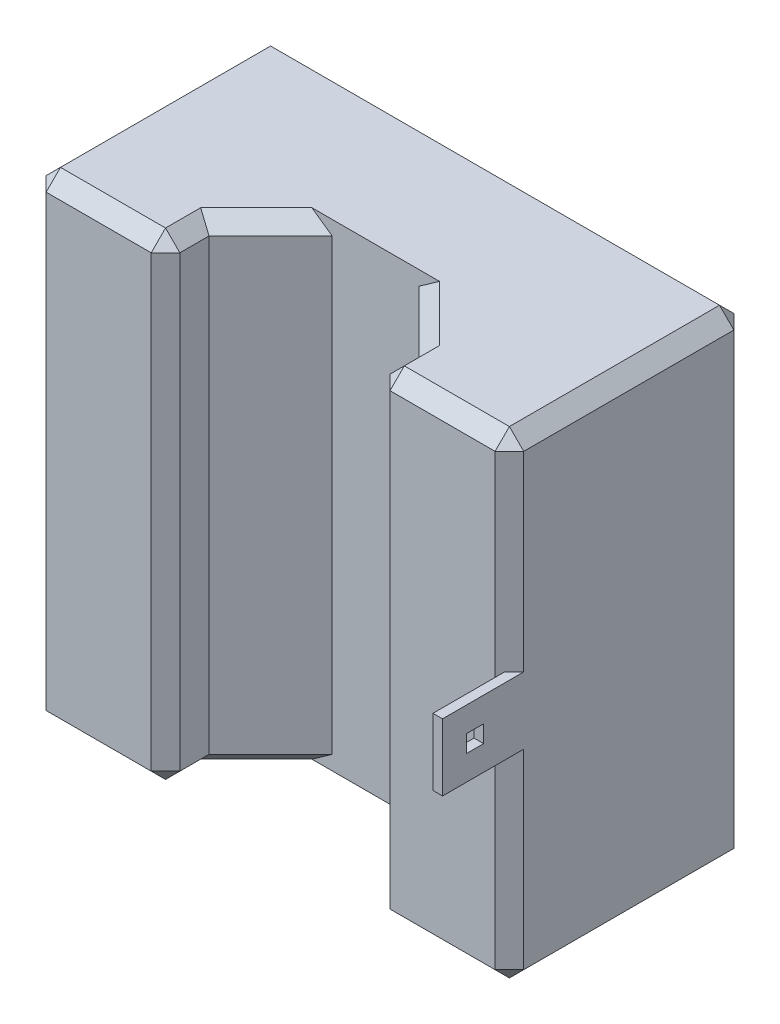
from build123d import *

# Parameters (mm, degrees)
SKETCH1_W                = 50
SKETCH1_H                = 50
BOSS_EXTRUDE1_DEPTH      = 25
CUT_EXTRUDE1_DEPTH       = 76
CHAMFER1_SIZE            = 1.5
BOSS_EXTRUDE2_DEPTH      = 7
BOSS_EXTRUDE2_DEPTH_BACK = 10
SKETCH3_W                = 1
SKETCH3_H                = 7
SKETCH4_W                = 1.8
SKETCH4_H                = 1.8
CUT_EXTRUDE2_DEPTH       = 7


with BuildPart() as part:
    # Sketch1 → Boss-Extrude1 (new body)
    with BuildSketch(Plane.XY):
        with Locations((25, 25)):
            Rectangle(SKETCH1_W, SKETCH1_H)
    extrude(amount=BOSS_EXTRUDE1_DEPTH)

    # Sketch2 → Cut-Extrude1 (cut, through all)
    with BuildSketch(Plane.XZ):
        Polygon((29.556349186, 36), (20.443650814, 36), (14, 29.556349186), (14, 20.443650814), (20.443650814, 14), (29.556349186, 14), (36, 20.443650814), (36, 29.556349186), align=None)
    extrude(amount=-CUT_EXTRUDE1_DEPTH, mode=Mode.SUBTRACT)

    # Chamfer1
    chamfer1_edges = [part.edges().sort_by_distance(p)[0] for p in [
        (50, 25, 25),
        (43, 50, 25),
        (43, 0, 25),
        (7, 50, 25),
        (14, 25, 25),
        (36, 25, 25),
        (36, 50, 22.721825407),
        (14, 50, 22.721825407),
        (36, 0, 22.721825407),
        (14, 0, 22.721825407),
        (17.221825407, 0, 17.221825407),
        (32.778174593, 0, 17.221825407),
        (32.778174593, 50, 17.221825407),
        (17.221825407, 50, 17.221825407),
        (0, 25, 25),
        (25, 50, 0),
        (50, 25, 0),
        (25, 0, 0),
        (0, 25, 0),
        (7, 0, 25),
        (0, 50, 12.5),
        (50, 50, 12.5),
        (50, 0, 12.5),
        (0, 0, 12.5),
    ]]
    chamfer(chamfer1_edges, length=CHAMFER1_SIZE)

    # Sketch3 → Boss-Extrude2 (add, two sides: drawn at the far end of the back side and taken through both)
    with BuildSketch(Plane.XY.offset(25).offset(-BOSS_EXTRUDE2_DEPTH_BACK)):
        with Locations((49.5, 25)):
            Rectangle(SKETCH3_W, SKETCH3_H)
    extrude(amount=BOSS_EXTRUDE2_DEPTH + BOSS_EXTRUDE2_DEPTH_BACK)

    # Sketch4 → Cut-Extrude2 (cut)
    with BuildSketch(Plane(origin=(50, 0, 0), x_dir=(0, 0, -1), z_dir=(1, 0, 0))):
        with Locations((-28.6, 25)):
            Rectangle(SKETCH4_W, SKETCH4_H)
    extrude(amount=-CUT_EXTRUDE2_DEPTH, mode=Mode.SUBTRACT)


solid = part.part
